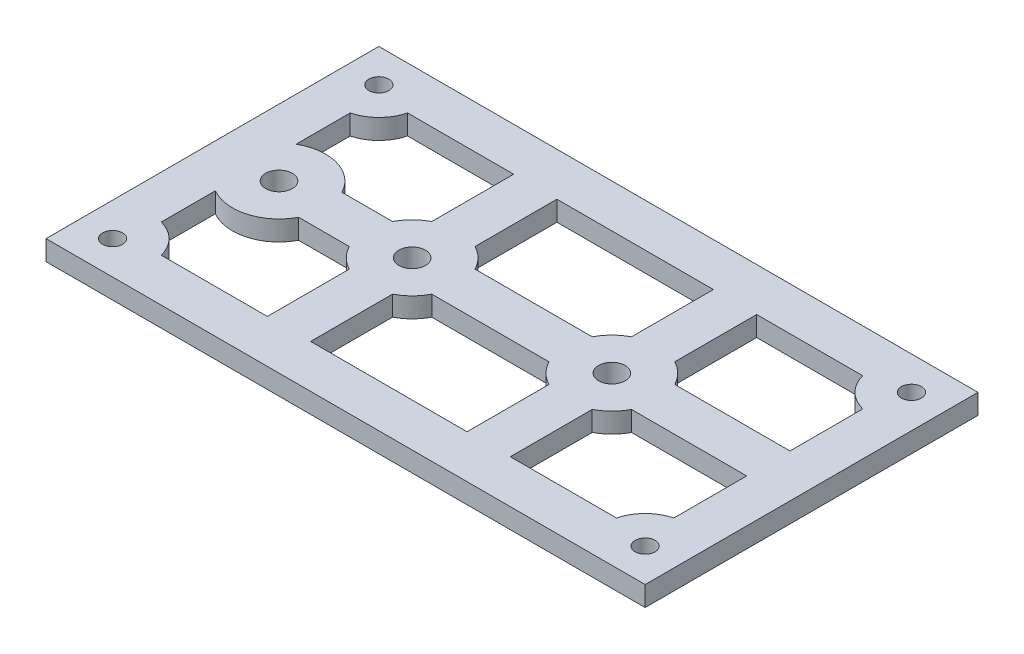
from build123d import *

# Parameters (mm, degrees)
SKETCH1_W           = 90
SKETCH1_H           = 50
BOSS_EXTRUDE1_DEPTH = 3
SKETCH3_R           = 2
CUT_EXTRUDE2_DEPTH  = 10
SKETCH2_R           = 1.5
CUT_EXTRUDE3_DEPTH  = 10


with BuildPart() as part:
    # Sketch1 → Boss-Extrude1 (new body)
    with BuildSketch(Plane(origin=(0, 0, 0), x_dir=(1, 0, 0), z_dir=(0, 1, 0))):
        Rectangle(SKETCH1_W, SKETCH1_H)
    extrude(amount=BOSS_EXTRUDE1_DEPTH)

    # Sketch3 → Cut-Extrude2 (cut)
    with BuildSketch(Plane(origin=(0, 3, 0), x_dir=(1, 0, 0), z_dir=(0, 1, 0))):
        with Locations(Location((-35, 0, 0), (0, 0, 270))):
            Circle(SKETCH3_R)
        with Locations(Location((-15, 0, 0), (0, 0, 270))):
            Circle(SKETCH3_R)
        with Locations(Location((15, 0, 0), (0, 0, 270))):
            Circle(SKETCH3_R)
    extrude(amount=-CUT_EXTRUDE2_DEPTH, mode=Mode.SUBTRACT)

    # Sketch2 → Cut-Extrude3 (cut)
    with BuildSketch(Plane(origin=(0, 3, 0), x_dir=(1, 0, 0), z_dir=(0, 1, 0))):
        with Locations(Location((-40, -20, 0), (0, 0, 270))):
            Circle(SKETCH2_R)
        with Locations(Location((40, -20, 0), (0, 0, 270))):
            Circle(SKETCH2_R)
        with Locations(Location((40, 20, 0), (0, 0, 270))):
            Circle(SKETCH2_R)
        with Locations(Location((-40, 20, 0), (0, 0, 270))):
            Circle(SKETCH2_R)
        with BuildLine():
            Line((38.5, -14.190524981), (38.5, -6.062177826))
            Line((38.5, -6.062177826), (38.5, -3.25))
            Line((38.5, -3.25), (28.800201616, -3.25))
            Line((28.800201616, -3.25), (21.199798384, -3.25))
            ThreePointArc((21.199798384, -3.25), (19.949747468, -4.949747468), (18.25, -6.199798384))
            Line((18.25, -6.199798384), (18.25, -18.5))
            Line((18.25, -18.5), (34.190524981, -18.5))
            ThreePointArc((34.190524981, -18.5), (35.757359313, -15.757359313), (38.5, -14.190524981))
        make_face()
        with BuildLine():
            Line((-34.190524981, -18.5), (-18.25, -18.5))
            Line((-18.25, -18.5), (-18.25, -6.199798384))
            ThreePointArc((-18.25, -6.199798384), (-19.949747468, -4.949747468), (-21.199798384, -3.25))
            Line((-21.199798384, -3.25), (-28.800201616, -3.25))
            ThreePointArc((-28.800201616, -3.25), (-33.05081713, -6.723145554), (-38.5, -6.062177826))
            Line((-38.5, -6.062177826), (-38.5, -14.190524981))
            ThreePointArc((-38.5, -14.190524981), (-35.757359313, -15.757359313), (-34.190524981, -18.5))
        make_face()
        with BuildLine():
            Line((38.5, 14.190524981), (38.5, 6.062177826))
            Line((38.5, 6.062177826), (38.5, 3.25))
            Line((38.5, 3.25), (28.800201616, 3.25))
            Line((28.800201616, 3.25), (21.199798384, 3.25))
            ThreePointArc((21.199798384, 3.25), (19.949747468, 4.949747468), (18.25, 6.199798384))
            Line((18.25, 6.199798384), (18.25, 18.5))
            Line((18.25, 18.5), (34.190524981, 18.5))
            ThreePointArc((34.190524981, 18.5), (35.757359313, 15.757359313), (38.5, 14.190524981))
        make_face()
        with BuildLine():
            Line((-38.5, 14.190524981), (-38.5, 6.062177826))
            ThreePointArc((-38.5, 6.062177826), (-33.05081713, 6.723145554), (-28.800201616, 3.25))
            Line((-28.800201616, 3.25), (-21.199798384, 3.25))
            ThreePointArc((-21.199798384, 3.25), (-19.949747468, 4.949747468), (-18.25, 6.199798384))
            Line((-18.25, 6.199798384), (-18.25, 18.5))
            Line((-18.25, 18.5), (-34.190524981, 18.5))
            ThreePointArc((-34.190524981, 18.5), (-35.757359313, 15.757359313), (-38.5, 14.190524981))
        make_face()
        with BuildLine():
            Line((-11.75, 18.5), (11.75, 18.5))
            Line((11.75, 18.5), (11.75, 6.199798384))
            ThreePointArc((11.75, 6.199798384), (10.050252532, 4.949747468), (8.800201616, 3.25))
            Line((8.800201616, 3.25), (-8.800201616, 3.25))
            ThreePointArc((-8.800201616, 3.25), (-10.050252532, 4.949747468), (-11.75, 6.199798384))
            Line((-11.75, 6.199798384), (-11.75, 18.5))
        make_face()
        with BuildLine():
            Line((-11.75, -18.5), (11.75, -18.5))
            Line((11.75, -18.5), (11.75, -6.199798384))
            ThreePointArc((11.75, -6.199798384), (10.050252532, -4.949747468), (8.800201616, -3.25))
            Line((8.800201616, -3.25), (-8.800201616, -3.25))
            ThreePointArc((-8.800201616, -3.25), (-10.050252532, -4.949747468), (-11.75, -6.199798384))
            Line((-11.75, -6.199798384), (-11.75, -18.5))
        make_face()
    extrude(amount=-CUT_EXTRUDE3_DEPTH, mode=Mode.SUBTRACT)


solid = part.part
